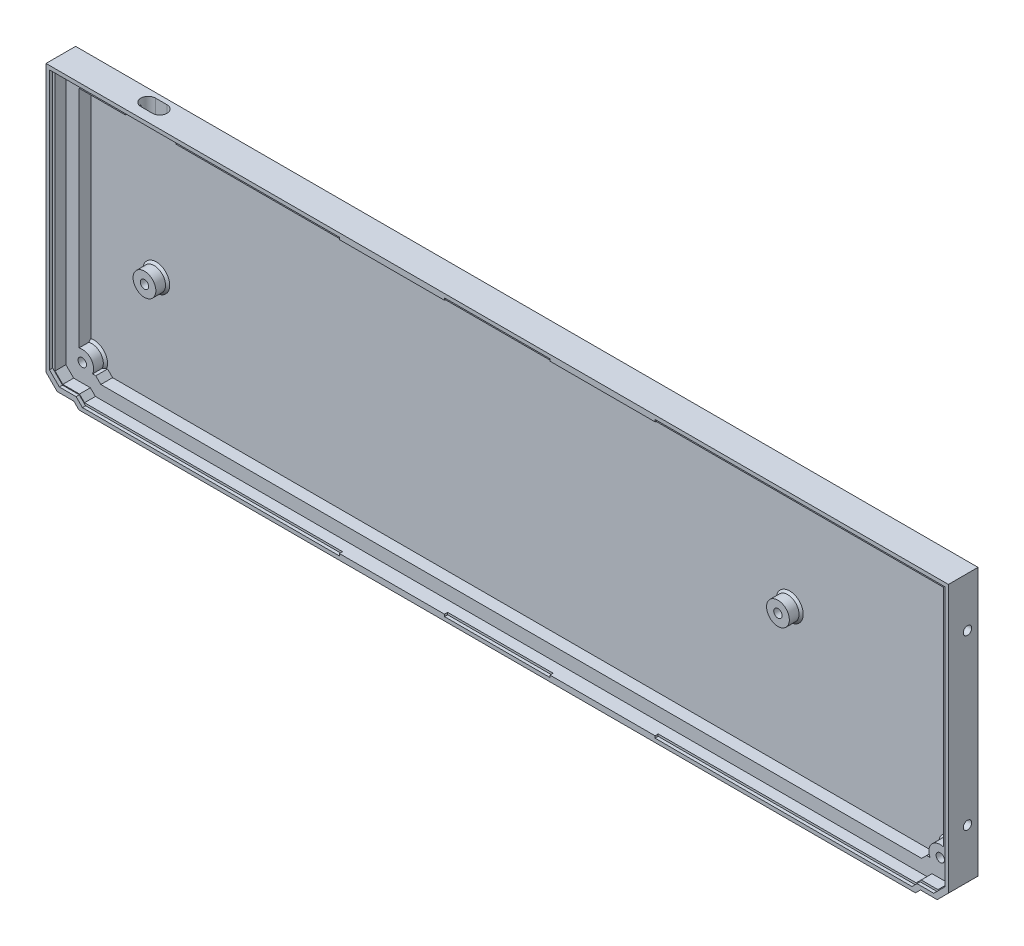
from build123d import *

# Parameters (mm, degrees)
P_IDAT_VYSUNUT_M1_DEPTH  = 5.6
SKO_EPINA1_T             = 1.8
P_IDAT_VYSUNUT_M3_DEPTH  = 5.15
P_IDAT_VYSUNUT_M4_DEPTH  = 7.4
P_IDAT_VYSUNUT_M5_DEPTH  = 1.5
SKICA14_W                = 49.9
SKICA14_H                = 0.995009232
P_IDAT_VYSUNUT_M6_DEPTH  = 1.5
SKICA15_R                = 5.4
SKICA15_W                = 3
SKICA15_H                = 9
P_IDAT_VYSUNUT_M7_DEPTH  = 5.6
SKICA16_R                = 2
ODEBRAT_VYSUNUT_M1_DEPTH = 5.75
ZKOSEN_1_SIZE            = 1
SKICA17_W                = 24
SKICA17_H                = 13.4
ODEBRAT_VYSUNUT_M2_DEPTH = 1.6
ODEBRAT_VYSUNUT_M3_REACH = 442.031
SKICA23_R                = 2
ODEBRAT_VYSUNUT_M4_DEPTH = 5.7
SKICA24_R                = 2
ODEBRAT_VYSUNUT_M5_DEPTH = 5.7
SKICA25_R                = 6.25
ODEBRAT_VYSUNUT_M6_DEPTH = 1.5


with BuildPart() as part:
    # Skica3 → Přidat vysunutím1 (new body)
    with BuildSketch(Plane.XY):
        Polygon((2.412545276, -4), (412.692715215, -4), (412.692715215, -118.191389918), (412.654731358, -118.229366948), (404.717731358, -118.229366948), (402.336688893, -120.609981536), (12.768122748, -120.609981536), (10.387229089, -118.22921813), (2.450229089, -118.22921813), (2.412545276, -118.191536378), align=None)
    extrude(amount=P_IDAT_VYSUNUT_M1_DEPTH)

    # Skořepina1
    sko_epina1_openings = [part.faces().sort_by_distance(p)[0] for p in [
        (207.552632266, -62.25279763, 5.6),
    ]]
    offset(amount=SKO_EPINA1_T, openings=sko_epina1_openings, kind=Kind.INTERSECTION)



with BuildPart() as body_2:
    # Skica7 → Přidat vysunutím3 (new body)
    with BuildSketch(Plane.XY.offset(5.6)):
        Polygon((-6.587454724, 5), (-6.587454724, -121.919602656), (-1.277548758, -127.22921813), (6.659451242, -127.22921813), (9.040344901, -129.609981536), (406.06413722, -129.609981536), (408.445179685, -127.229366948), (416.382179685, -127.229366948), (421.692715215, -121.919785731), (421.692715215, 5), align=None)
        Polygon((-3.787454724, 2.2), (-3.787454724, -120.759759814), (-0.11779565, -124.42921813), (7.81920435, -124.42921813), (10.200098009, -126.809981536), (404.904486629, -126.809981536), (407.285529094, -124.429366948), (415.222529094, -124.429366948), (418.892715215, -120.759840367), (418.892715215, 2.2), align=None, mode=Mode.SUBTRACT)
    extrude(amount=P_IDAT_VYSUNUT_M3_DEPTH)


with BuildPart() as part_1:
    add(part.part)

    add(body_2.part)  # Přidat vysunutím4 merges body 2
    # Skica8 → Přidat vysunutím4 (add)
    with BuildSketch(Plane(origin=(0, 0, 5.6), x_dir=(-1, 0, 0), z_dir=(0, 0, -1))):
        Polygon((-421.692715215, 5), (6.587454724, 5), (6.587454724, -121.919602656), (1.277548758, -127.22921813), (-6.659451242, -127.22921813), (-9.040344901, -129.609981536), (-406.06413722, -129.609981536), (-408.445179685, -127.229366948), (-416.382179685, -127.229366948), (-421.692715215, -121.919785731), align=None)
        Polygon((-0.612545276, -2.2), (-0.612545276, -118.937149634), (-1.70467352, -120.02921813), (-9.64167352, -120.02921813), (-12.022567179, -122.409981536), (-403.082178558, -122.409981536), (-405.463221024, -120.029366948), (-413.400221024, -120.029366948), (-414.492715215, -118.93706908), (-414.492715215, -2.2), align=None, mode=Mode.SUBTRACT)
    extrude(amount=P_IDAT_VYSUNUT_M4_DEPTH)

    # Skica11 → Přidat vysunutím5 (add)
    with BuildSketch(Plane.XY.offset(10.75)):
        Polygon((421.692715215, 5), (-6.587454724, 5), (-6.587454724, -121.919602656), (-1.277548758, -127.22921813), (6.659451242, -127.22921813), (9.040344901, -129.609981536), (406.06413722, -129.609981536), (408.445179685, -127.229366948), (416.382179685, -127.229366948), (421.692715215, -121.919785731), align=None)
        Polygon((420.052630246, 3.195009232), (-4.947369754, 3.195009232), (-4.947369754, -120.114611888), (-0.239981646, -124.821742467), (7.697018354, -124.821742467), (10.68042987, -127.804990768), (404.42405225, -127.804990768), (406.805094715, -125.424376181), (414.742094715, -125.424376181), (420.052630246, -120.114794964), align=None, mode=Mode.SUBTRACT)
    extrude(amount=P_IDAT_VYSUNUT_M5_DEPTH)

    # Skica14 → Přidat vysunutím6 (add)
    with BuildSketch(Plane.XY.offset(10.75)):
        with Locations((157.582630246, 2.697504616)):
            Rectangle(SKICA14_W, SKICA14_H)
        with Locations((257.522630246, 2.697504616)):
            Rectangle(SKICA14_W, SKICA14_H)
        with Locations((257.52224106, -127.307486152)):
            Rectangle(SKICA14_W, SKICA14_H)
        with Locations((157.58224106, -127.307486152)):
            Rectangle(SKICA14_W, SKICA14_H)
    extrude(amount=P_IDAT_VYSUNUT_M6_DEPTH)

    # Skica15 → Přidat vysunutím7 (add)
    with BuildSketch(Plane.XY):
        with Locations((3.968545276, -115.95421813)):
            Circle(SKICA15_R)
        with Locations((33.491545276, -69.050981536)):
            Circle(SKICA15_R)
        with Locations((411.197715215, -115.879366948)):
            Circle(SKICA15_R)
        with Locations((334.147715215, -53.972)):
            Circle(SKICA15_R)
        with Locations((36.401545276, 0)):
            Rectangle(SKICA15_W, SKICA15_H)
    extrude(amount=P_IDAT_VYSUNUT_M7_DEPTH)

    # Skica16 → Odebrat vysunutím1 (cut)
    with BuildSketch(Plane.XY.offset(5.6)):
        with Locations((3.968545276, -115.95421813)):
            Circle(SKICA16_R)
        with Locations((33.491545276, -69.050981536)):
            Circle(SKICA16_R)
        with Locations((334.147715215, -53.972)):
            Circle(SKICA16_R)
        with Locations((411.197715215, -115.879366948)):
            Circle(SKICA16_R)
    extrude(amount=-ODEBRAT_VYSUNUT_M1_DEPTH, mode=Mode.SUBTRACT)

    # Zkosení1
    zkosen_1_edges = [part_1.edges().sort_by_distance(p)[0] for p in [
        (8.049207709, -112.417525591, 0),
        (28.091545276, -69.050981536, 0),
        (407.069426922, -112.398384936, 0),
        (328.747715215, -53.972, 0),
    ]]
    chamfer(zkosen_1_edges, length=ZKOSEN_1_SIZE)

    # Skica17 → Odebrat vysunutím2 (cut)
    with BuildSketch(Plane.XY.offset(5.6)):
        with Locations((36.401545276, -4.5)):
            Rectangle(SKICA17_W, SKICA17_H)
    extrude(amount=-ODEBRAT_VYSUNUT_M2_DEPTH, mode=Mode.SUBTRACT)

    # Odebrat vysunutím3: up to this face of the body (flat: up to its plane)
    odebrat_vysunut_m3_end = Plane(part_1.part.faces().sort_by_distance((207.552630246, 5, 5.225))[0])
    # Skica18 → Odebrat vysunutím3 (cut, up to the picked face)
    with BuildSketch(Plane.XZ.offset(4.5), mode=Mode.PRIVATE) as odebrat_vysunut_m3_sk1:
        with BuildLine():
            Line((33.651545276, 7.5), (39.151545276, 7.5))
            ThreePointArc((39.151545276, 7.5), (42.651545276, 4), (39.151545276, 0.5))
            Line((39.151545276, 0.5), (33.651545276, 0.5))
            ThreePointArc((33.651545276, 0.5), (30.151545276, 4), (33.651545276, 7.5))
        make_face()
    odebrat_vysunut_m3_tool1 = split(extrude(odebrat_vysunut_m3_sk1.sketch, amount=-ODEBRAT_VYSUNUT_M3_REACH, mode=Mode.PRIVATE), bisect_by=odebrat_vysunut_m3_end, keep=Keep.BOTH, mode=Mode.PRIVATE)
    add(odebrat_vysunut_m3_tool1.solids().sort_by(Axis((36.401545, -4.5, 4), (0, 1, 0)))[0], mode=Mode.SUBTRACT)

    # Skica23 → Odebrat vysunutím4 (cut)
    with BuildSketch(Plane.ZY.offset(6.587454724)):
        with Locations((3.2, -18.459801328)):
            Circle(SKICA23_R)
        with Locations((3.2, -98.459801328)):
            Circle(SKICA23_R)
    extrude(amount=-ODEBRAT_VYSUNUT_M4_DEPTH, mode=Mode.SUBTRACT)

    # Skica24 → Odebrat vysunutím5 (cut)
    with BuildSketch(Plane(origin=(421.692715215, 0, 0), x_dir=(0, 0, -1), z_dir=(1, 0, 0))):
        with Locations((-3.2, -18.459892866)):
            Circle(SKICA24_R)
        with Locations((-3.2, -98.459892866)):
            Circle(SKICA24_R)
    extrude(amount=-ODEBRAT_VYSUNUT_M5_DEPTH, mode=Mode.SUBTRACT)

    # Skica25 → Odebrat vysunutím6 (cut)
    with BuildSketch(Plane(origin=(0, 0, -1.8), x_dir=(-1, 0, 0), z_dir=(0, 0, -1))):
        with Locations((-401.692715215, -15)):
            Circle(SKICA25_R)
        with Locations((-13.412545276, -15)):
            Circle(SKICA25_R)
        with Locations((-388.445179685, -109.609981536)):
            Circle(SKICA25_R)
        with Locations((-26.659451242, -109.609981536)):
            Circle(SKICA25_R)
    extrude(amount=-ODEBRAT_VYSUNUT_M6_DEPTH, mode=Mode.SUBTRACT)


solid = part_1.part
